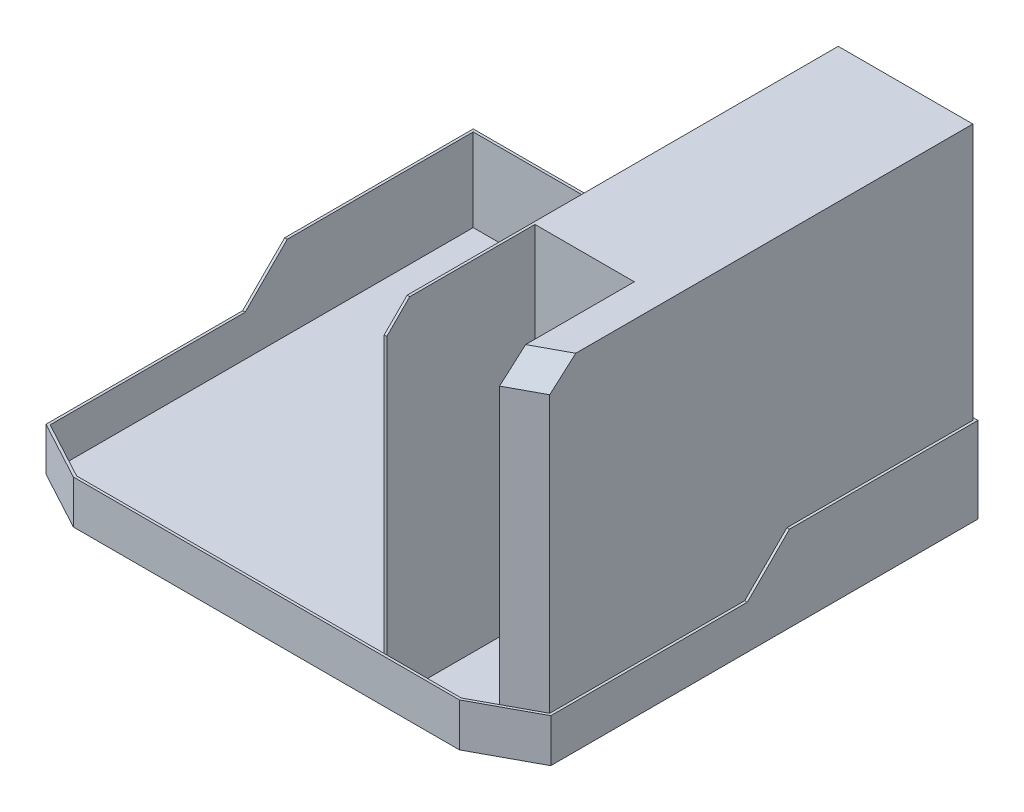
from build123d import *

# Parameters (mm, degrees)
BOSS_EXTRUDE3_DEPTH    = 370
SKETCH3_W              = 619.706220458
SKETCH3_H              = 524.5
BOSS_EXTRUDE4_DEPTH    = 50
BOSS_EXTRUDE6_DEPTH    = 420
CHAMFER1_SIZE          = 30
SHELL1_T               = -3.18
CUT_EXTRUDE1_DEPTH     = 10
BOSS_EXTRUDE7_REACH    = 652.082
SKETCH13_W             = 122.046220458
SKETCH13_H             = 233.985108613
CUT_EXTRUDE3_DEPTH     = 651.08233795
SPLIT2_SURFACE_1_BACK  = 938.174
SPLIT2_SURFACE_1_DEPTH = 1876.348
BOSS_EXTRUDE8_DEPTH    = 3.18


with BuildPart() as part:
    # Sketch1 → Boss-Extrude3 (new body)
    with BuildSketch(Plane(origin=(0, 0, 0), x_dir=(1, 0, 0), z_dir=(0, 1, 0))):
        Polygon((225.65, -262.25), (394.056220458, -262.25), (394.056220458, 262.25), (225.65, 262.25), (-225.65, 262.25), (-225.65, -262.25), align=None)
    extrude(amount=BOSS_EXTRUDE3_DEPTH)

    # Sketch3 → Boss-Extrude4 (add)
    with BuildSketch(Plane(origin=(0, 370, 0), x_dir=(1, 0, 0), z_dir=(0, 1, 0))):
        with Locations((84.203110229, 0)):
            Rectangle(SKETCH3_W, SKETCH3_H)
    extrude(amount=BOSS_EXTRUDE4_DEPTH)

    # Sketch9 → Boss-Extrude6 (add)
    with BuildSketch(Plane(origin=(0, 0, 0), x_dir=(1, 0, 0), z_dir=(0, 1, 0))):
        Polygon((-225.65, -262.25), (-152.747945688, -301.540612909), (321.154166146, -301.540612909), (394.056220458, -262.25), align=None)
    extrude(amount=BOSS_EXTRUDE6_DEPTH)

    # Chamfer1
    chamfer1_edges = [part.edges().sort_by_distance(p)[0] for p in [
        (-189.198972844, 420, 281.895306454),
        (84.203110229, 420, 301.540612909),
        (357.605193302, 420, 281.895306454),
    ]]
    chamfer(chamfer1_edges, length=CHAMFER1_SIZE)

    # Shell1
    shell1_openings = [part.faces().sort_by_distance(p)[0] for p in [
        (84.203110229, 0, 17.423394881),
    ]]
    offset(amount=SHELL1_T, openings=shell1_openings, kind=Kind.INTERSECTION)

    # Sketch7 → Cut-Extrude1 (cut)
    with BuildSketch(Plane.ZY.offset(225.65)):
        Polygon((-19.07, 315), (-19.07, 230), (20.93, 190), (80.93, 190), (120.93, 230), (120.93, 315), align=None)
    extrude(amount=-CUT_EXTRUDE1_DEPTH, mode=Mode.SUBTRACT)


with BuildPart() as body_2:

    # Sketch12 → Boss-Extrude7 (new, up to next)
    with BuildSketch(Plane(origin=(0, 0, 0), x_dir=(1, 0, 0), z_dir=(0, 1, 0)), mode=Mode.PRIVATE) as boss_extrude7_sk1:
        Polygon((225.65, -262.25), (225.65, -298.360612909), (320.351791074, -298.360612909), (390.876220458, -260.35142261), (390.876220458, 259.07), (225.65, 259.07), align=None)
    boss_extrude7_tool1 = extrude(boss_extrude7_sk1.sketch, amount=BOSS_EXTRUDE7_REACH, mode=Mode.PRIVATE) - part.part
    add(boss_extrude7_tool1.solids().sort_by_distance((307.390302, 0, 15.716589))[0])

    # Sketch13 → Cut-Extrude3 (cut, through all)
    with BuildSketch(Plane.XZ):
        with Locations((289.853110229, 233.456942929)):
            Rectangle(SKETCH13_W, SKETCH13_H)
    extrude(amount=-CUT_EXTRUDE3_DEPTH, mode=Mode.SUBTRACT)


with BuildPart() as part_1:
    add(part.part)

    # Split2: cut with a surface, the side it looks to stays
    # Split2 surface: a surface, the sketch's curves swept straight by 1876.348 mm
    with BuildLine(Plane.ZY.offset(225.65).offset(-SPLIT2_SURFACE_1_BACK), mode=Mode.PRIVATE) as split2_surface_1_path:
        Line((377.982656301, 50), (20.93, 50))
        Line((20.93, 50), (-30.817816509, 101.747816509))
        Line((-30.817816509, 101.747816509), (-303.707153017, 101.747816509))
    split2_surface_1 = Shell.extrude(split2_surface_1_path.wire(), (-1 * SPLIT2_SURFACE_1_DEPTH, 0 * SPLIT2_SURFACE_1_DEPTH, 0 * SPLIT2_SURFACE_1_DEPTH))
    split(bisect_by=split2_surface_1, keep=Keep.TOP)

    add(body_2.part)  # Boss-Extrude8 merges body 2
    # Sketch14 → Boss-Extrude8 (add)
    with BuildSketch(Plane.XZ):
        Polygon((394.056220458, 262.25), (394.056220458, -262.25), (-225.65, -262.25), (-225.65, 262.25), (-152.747945688, 301.540612909), (321.154166146, 301.540612909), align=None)
    extrude(amount=BOSS_EXTRUDE8_DEPTH)


solid = part_1.part
